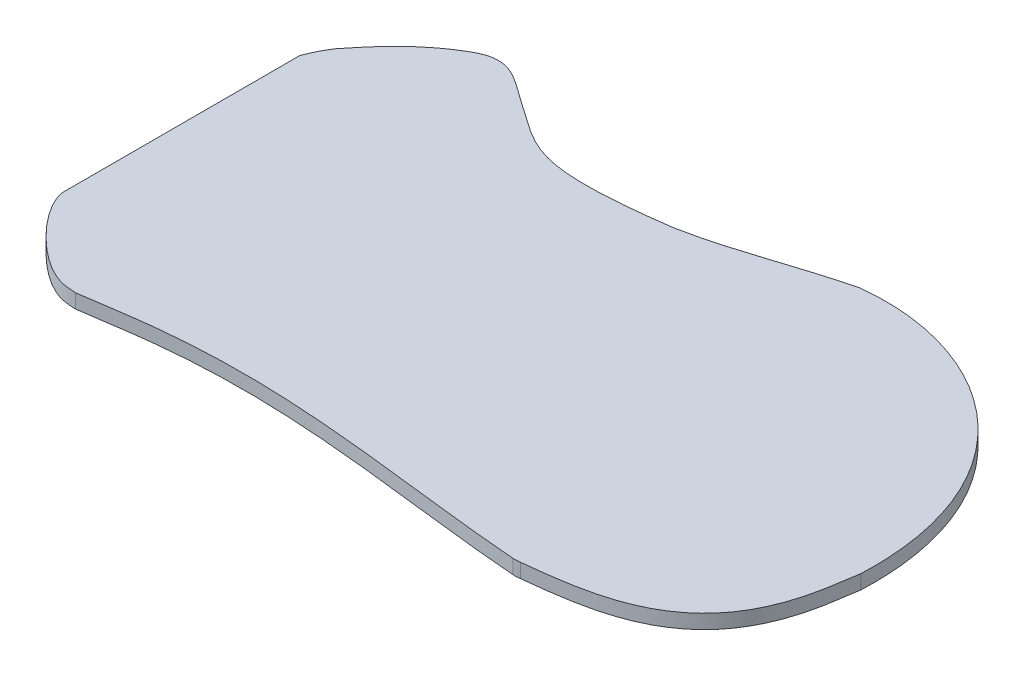
from build123d import *

# Parameters (mm, degrees)
BOSS_EXTRUDE2_DEPTH      = 3
SKETCH2_R                = 6
BOSS_EXTRUDE3_DEPTH      = 2.5
SKETCH4_R                = 2.5
CUT_EXTRUDE1_DEPTH       = 2.5
LPATTERN1_COUNT          = 3
LPATTERN1_PITCH          = 20
LPATTERN1_COUNT_DIR2     = 6
LPATTERN1_PITCH_DIR2     = 20
CUT_EXTRUDE2_DEPTH       = 10
MIRROR1_COPY_1_SKETCH_R  = 6
MIRROR1_COPY_1_DEPTH     = 2.5
MIRROR1_COPY_2_SKETCH_R  = 6
MIRROR1_COPY_2_DEPTH     = 2.5
MIRROR1_COPY_3_SKETCH_R  = 6
MIRROR1_COPY_3_DEPTH     = 2.5
MIRROR1_COPY_4_SKETCH_R  = 6
MIRROR1_COPY_4_DEPTH     = 2.5
MIRROR1_COPY_5_SKETCH_R  = 6
MIRROR1_COPY_5_DEPTH     = 2.5
MIRROR1_COPY_6_SKETCH_R  = 6
MIRROR1_COPY_6_DEPTH     = 2.5
MIRROR1_COPY_7_SKETCH_R  = 6
MIRROR1_COPY_7_DEPTH     = 2.5
MIRROR1_COPY_8_SKETCH_R  = 6
MIRROR1_COPY_8_DEPTH     = 2.5
MIRROR1_COPY_9_SKETCH_R  = 6
MIRROR1_COPY_9_DEPTH     = 2.5
MIRROR1_COPY_10_SKETCH_R = 6
MIRROR1_COPY_10_DEPTH    = 2.5
MIRROR1_COPY_11_SKETCH_R = 6
MIRROR1_COPY_11_DEPTH    = 2.5
MIRROR1_COPY_12_SKETCH_R = 6
MIRROR1_COPY_12_DEPTH    = 2.5
MIRROR1_COPY_13_SKETCH_R = 6
MIRROR1_COPY_13_DEPTH    = 2.5
MIRROR1_COPY_14_SKETCH_R = 6
MIRROR1_COPY_14_DEPTH    = 2.5
MIRROR1_COPY_15_SKETCH_R = 6
MIRROR1_COPY_15_DEPTH    = 2.5
MIRROR1_COPY_16_SKETCH_R = 6
MIRROR1_COPY_16_DEPTH    = 2.5
MIRROR1_COPY_17_SKETCH_R = 6
MIRROR1_COPY_17_DEPTH    = 2.5
MIRROR1_COPY_18_SKETCH_R = 2.5
MIRROR1_COPY_18_DEPTH    = 2.5
MIRROR1_COPY_19_SKETCH_R = 2.5
MIRROR1_COPY_19_DEPTH    = 2.5
MIRROR1_COPY_20_SKETCH_R = 2.5
MIRROR1_COPY_20_DEPTH    = 2.5
MIRROR1_COPY_21_SKETCH_R = 2.5
MIRROR1_COPY_21_DEPTH    = 2.5
MIRROR1_COPY_22_SKETCH_R = 2.5
MIRROR1_COPY_22_DEPTH    = 2.5
MIRROR1_COPY_23_SKETCH_R = 2.5
MIRROR1_COPY_23_DEPTH    = 2.5
MIRROR1_COPY_24_SKETCH_R = 2.5
MIRROR1_COPY_24_DEPTH    = 2.5
MIRROR1_COPY_25_SKETCH_R = 2.5
MIRROR1_COPY_25_DEPTH    = 2.5
MIRROR1_COPY_26_SKETCH_R = 2.5
MIRROR1_COPY_26_DEPTH    = 2.5
MIRROR1_COPY_27_SKETCH_R = 2.5
MIRROR1_COPY_27_DEPTH    = 2.5
MIRROR1_COPY_28_SKETCH_R = 2.5
MIRROR1_COPY_28_DEPTH    = 2.5
MIRROR1_COPY_29_SKETCH_R = 2.5
MIRROR1_COPY_29_DEPTH    = 2.5
MIRROR1_COPY_30_SKETCH_R = 2.5
MIRROR1_COPY_30_DEPTH    = 2.5
MIRROR1_COPY_31_SKETCH_R = 2.5
MIRROR1_COPY_31_DEPTH    = 2.5
MIRROR1_COPY_32_SKETCH_R = 2.5
MIRROR1_COPY_32_DEPTH    = 2.5
MIRROR1_COPY_33_SKETCH_R = 2.5
MIRROR1_COPY_33_DEPTH    = 2.5
MIRROR1_COPY_34_SKETCH_R = 2.5
MIRROR1_COPY_34_DEPTH    = 2.5
SKETCH6_W                = 220.416558685
SKETCH6_H                = 214.356996935
CUT_EXTRUDE3_DEPTH       = 10


with BuildPart() as part:
    # Sketch1 → Boss-Extrude2 (new body)
    with BuildSketch(Plane(origin=(0, 0, 0), x_dir=(1, 0, 0), z_dir=(0, 1, 0))):
        with BuildLine():
            Line((-77.610928287, 24.73480995), (-77.610926739, -10.995486899))
            Line((-77.610926739, -10.995486899), (77.512336703, -10.995486899))
            add(Edge.make_bspline(
                [(77.512336703, -10.995486899), (77.518560385, -10.957874405), (77.524814965, -10.920112686), (77.531107112, -10.882121857)],
                knots=[1.010486637, 1.010486637, 1.010486637, 1.010486637, 1.01412385, 1.01412385, 1.01412385, 1.01412385], degree=3))
            add(Edge.make_bspline(
                [(77.531107112, -10.882121857), (77.574839436, -9.766511083), (77.609892635, -7.507402328), (77.488817492, -4.272864758), (77.205757806, -1.125162749), (76.619514408, 2.937285367), (75.50877626, 7.753752623), (72.989524017, 14.905909338), (68.566776195, 22.780014071), (61.595696469, 30.463398286), (53.335691478, 36.314584962), (44.158321293, 40.264828436), (34.449835996, 42.250559646), (27.85746121, 42.205857253), (24.60638519, 41.843406408)],
                knots=[0.000169226, 0.000169226, 0.000169226, 0.000169226, 0.031413574, 0.062657922, 0.09390227, 0.125146618, 0.187635314, 0.25012401, 0.375101401, 0.500078793, 0.625056185, 0.750033577, 0.875010969, 0.999988361, 0.999988361, 0.999988361, 0.999988361], degree=3))
            add(Edge.make_bspline(
                [(24.60638519, 41.843406408), (19.441654305, 40.599557497), (11.868641969, 38.10186056), (1.706905963, 34.941445063), (-3.490903085, 33.661503777), (-6.113060784, 33.160531214)],
                knots=[0.000658959, 0.000658959, 0.000658959, 0.000658959, 0.498067368, 0.746771573, 0.995475778, 0.995475778, 0.995475778, 0.995475778], degree=3))
            add(Edge.make_bspline(
                [(-6.113060784, 33.160531214), (-7.141691771, 33.016316508), (-9.182526978, 32.742024746), (-13.41706461, 32.236967498), (-18.636406478, 31.76535684), (-24.35525076, 31.602322531), (-29.284430774, 31.960023989), (-33.420361612, 32.921566077), (-36.371506688, 34.261606006), (-38.649706949, 35.648097323), (-40.392953753, 36.835956096), (-41.960752384, 37.950009586), (-43.317594841, 38.899351268), (-44.070083407, 39.410677407), (-44.439121999, 39.658722592)],
                knots=[-0.00019559, -0.00019559, -0.00019559, -0.00019559, 0.062587211, 0.125370012, 0.250935613, 0.376501215, 0.502066816, 0.627632417, 0.753198019, 0.81598082, 0.87876362, 0.941546421, 0.972937821, 1.004329222, 1.004329222, 1.004329222, 1.004329222], degree=3))
            add(Edge.make_bspline(
                [(-44.439121999, 39.658722592), (-44.698278493, 39.837478936), (-45.221943057, 40.202686415), (-46.204449693, 40.903278583), (-47.345032131, 41.729218311), (-48.599765224, 42.619793879), (-50.15090873, 43.651280208), (-51.914572875, 44.618913698), (-53.861511808, 45.22944075), (-55.705524128, 45.327541985), (-57.164765963, 45.050979151), (-58.248551256, 44.683932663), (-59.000335406, 44.361625817), (-59.68368912, 44.01293032), (-60.037538284, 43.806100934), (-60.223947924, 43.693990747)],
                knots=[-0.002497219, -0.002497219, -0.002497219, -0.002497219, 0.029065652, 0.060628523, 0.123754265, 0.186880007, 0.250005749, 0.376257234, 0.502508718, 0.628760202, 0.755011687, 0.818137429, 0.881263171, 0.944388913, 1.007514655, 1.007514655, 1.007514655, 1.007514655], degree=3))
            add(Edge.make_bspline(
                [(-60.223947924, 43.693990747), (-60.647418813, 43.446259773), (-61.492438659, 42.931359573), (-63.090560833, 41.877343183), (-65.712449046, 39.946479206), (-68.970886279, 37.019932698), (-71.698068002, 34.035828956), (-73.643714468, 31.694824796), (-74.523586793, 30.588052824), (-74.969576783, 30.022283972)],
                knots=[0.000174078, 0.000174078, 0.000174078, 0.000174078, 0.062881444, 0.12558881, 0.251003541, 0.501833004, 0.752662466, 0.878077198, 1.003491929, 1.003491929, 1.003491929, 1.003491929], degree=3))
            add(Edge.make_bspline(
                [(-74.969576783, 30.022283972), (-75.519545883, 29.19186114), (-76.530249869, 27.448037515), (-77.287396087, 25.657695857), (-77.610928287, 24.73480995)],
                knots=[0.499549048, 0.499549048, 0.499549048, 0.499549048, 0.499765799, 0.49998255, 0.49998255, 0.49998255, 0.49998255], degree=3))
        make_face()
        with BuildLine():
            Line((77.512336703, -10.995486899), (-77.610926739, -10.995486899))
            Line((-77.610926739, -10.995486899), (-77.610926696, -11.995486899))
            Line((-77.610926696, -11.995486899), (77.352572442, -11.995486899))
            add(Edge.make_bspline(
                [(77.352572442, -11.995486899), (77.358645684, -11.955275612), (77.412259186, -11.602816601), (77.464316371, -11.285695229), (77.512336703, -10.995486899)],
                knots=[0.978851886, 0.978851886, 0.978851886, 0.978851886, 0.982422834, 1.010486637, 1.010486637, 1.010486637, 1.010486637], degree=3))
        make_face()
        with BuildLine():
            Line((77.352572442, -11.995486899), (-77.610926696, -11.995486899))
            Line((-77.610926696, -11.995486899), (-77.610926126, -25.14203309))
            add(Edge.make_bspline(
                [(-77.610926126, -25.14203309), (-77.610329581, -25.399956565), (-77.56299042, -25.903042711), (-77.289715127, -26.985745976), (-76.641681648, -28.530602527), (-75.497775654, -30.448110961), (-73.605831916, -33.039049782), (-70.803315368, -36.111993436), (-67.327412016, -39.127002194), (-64.140223394, -41.243972104), (-61.455644843, -42.436069514), (-59.281170991, -42.877843858), (-58.025592683, -42.909198362), (-57.3728408, -42.946603583)],
                knots=[0.000484301, 0.000484301, 0.000484301, 0.000484301, 0.031521334, 0.062558366, 0.124632431, 0.186706496, 0.248780561, 0.37292869, 0.49707682, 0.62122495, 0.745373079, 0.869521209, 0.993669339, 0.993669339, 0.993669339, 0.993669339], degree=3))
            add(Edge.make_bspline(
                [(-57.3728408, -42.946603583), (-57.13064829, -42.917162583), (-56.655899826, -42.857244252), (-55.632891969, -42.716833971), (-54.283173397, -42.517569574), (-52.529691334, -42.248220025), (-50.028198289, -41.865201142), (-46.600250729, -41.367044153), (-42.036258597, -40.811127611), (-37.051373779, -40.355934431), (-29.881163552, -39.94286355), (-20.010895236, -39.876612938), (-6.937670032, -40.617368244), (4.79101559, -41.816338855), (14.569227449, -42.959318591), (22.067232439, -43.838869966), (29.700051426, -44.671831852), (34.887053568, -45.137323321), (37.472492496, -45.32880882)],
                knots=[0.000538145, 0.000538145, 0.000538145, 0.000538145, 0.016151963, 0.031765781, 0.062993416, 0.094221052, 0.125448688, 0.18790396, 0.250359232, 0.312814503, 0.375269775, 0.500180319, 0.625090862, 0.750001406, 0.812456678, 0.874911949, 0.937367221, 0.999822493, 0.999822493, 0.999822493, 0.999822493], degree=3))
            ThreePointArc((37.472492496, -45.32880882), (38.248733412, -45.324262341), (39.021479233, -45.250543112))
            add(Edge.make_bspline(
                [(39.021479233, -45.250543112), (40.554063275, -45.087269156), (43.636191946, -44.744534775), (49.629747374, -43.872748427), (56.64310661, -42.215757501), (63.76459646, -38.913707507), (69.322535256, -34.215518596), (72.595951354, -29.308690908), (74.463908277, -25.056718438), (75.526739474, -21.803040338), (76.297079472, -18.602211114), (76.745734786, -16.093857572), (77.025988143, -14.25776708), (77.200159766, -13.042150967), (77.304730613, -12.312250405), (77.352572442, -11.995486899)],
                knots=[-0.000308659, -0.000308659, -0.000308659, -0.000308659, 0.063093373, 0.126495404, 0.253299468, 0.380103532, 0.506907596, 0.633711659, 0.697113691, 0.760515723, 0.823917755, 0.887319787, 0.919020803, 0.950721818, 0.978851886, 0.978851886, 0.978851886, 0.978851886], degree=3))
        make_face()
    boss_extrude2 = extrude(amount=BOSS_EXTRUDE2_DEPTH)

    # Sketch2 → Boss-Extrude3 (add)
    with BuildSketch(Plane(origin=(0, 3, 0), x_dir=(1, 0, 0), z_dir=(0, 1, 0))):
        with Locations(Location((-52.601285046, 19.444993701, 0), (0, 0, 270))):
            Circle(SKETCH2_R)
    boss_extrude3 = extrude(amount=BOSS_EXTRUDE3_DEPTH)

    # Sketch4 → Cut-Extrude1 (cut)
    with BuildSketch(Plane(origin=(0, 5.5, 0), x_dir=(1, 0, 0), z_dir=(0, 1, 0))):
        with Locations(Location((-52.601285046, 19.444993701, 0), (0, 0, 270))):
            Circle(SKETCH4_R)
    cut_extrude1 = extrude(amount=-CUT_EXTRUDE1_DEPTH, mode=Mode.SUBTRACT)

    # LPattern1: Boss-Extrude3, Cut-Extrude1 3 × 6
    with Locations(*[(j * LPATTERN1_PITCH_DIR2, 0, i * LPATTERN1_PITCH) for i in range(LPATTERN1_COUNT) for j in range(LPATTERN1_COUNT_DIR2) if (i, j) != (0, 0)]):
        add(boss_extrude3)
        add(cut_extrude1, mode=Mode.SUBTRACT)

    # Sketch5 → Cut-Extrude2 (cut)
    with BuildSketch(Plane.XZ):
        with BuildLine():
            Line((-77.610926126, 25.14203309), (-77.610928287, -24.73480995))
            add(Edge.make_bspline(
                [(-77.610928287, -24.73480995), (-77.287396087, -25.657695857), (-76.530249869, -27.448037515), (-75.519545883, -29.19186114), (-74.969576783, -30.022283972)],
                knots=[0.499549048, 0.499549048, 0.499549048, 0.499549048, 0.499765799, 0.49998255, 0.49998255, 0.49998255, 0.49998255], degree=3))
            add(Edge.make_bspline(
                [(-74.969576783, -30.022283972), (-74.523586793, -30.588052824), (-73.643714468, -31.694824796), (-71.698068002, -34.035828956), (-68.970886279, -37.019932698), (-65.712449046, -39.946479206), (-63.090560833, -41.877343183), (-61.492438659, -42.931359573), (-60.647418813, -43.446259773), (-60.223947924, -43.693990747)],
                knots=[0.000174078, 0.000174078, 0.000174078, 0.000174078, 0.12558881, 0.251003541, 0.501833004, 0.752662466, 0.878077198, 0.940784563, 1.003491929, 1.003491929, 1.003491929, 1.003491929], degree=3))
            add(Edge.make_bspline(
                [(-60.223947924, -43.693990747), (-60.037538284, -43.806100934), (-59.68368912, -44.01293032), (-59.000335406, -44.361625817), (-58.248551256, -44.683932663), (-57.164765963, -45.050979151), (-55.705524128, -45.327541985), (-53.861511808, -45.22944075), (-51.914572875, -44.618913698), (-50.15090873, -43.651280208), (-48.599765224, -42.619793879), (-47.345032131, -41.729218311), (-46.204449693, -40.903278583), (-45.221943057, -40.202686415), (-44.698278493, -39.837478936), (-44.439121999, -39.658722592)],
                knots=[-0.002497219, -0.002497219, -0.002497219, -0.002497219, 0.060628523, 0.123754265, 0.186880007, 0.250005749, 0.376257234, 0.502508718, 0.628760202, 0.755011687, 0.818137429, 0.881263171, 0.944388913, 0.975951784, 1.007514655, 1.007514655, 1.007514655, 1.007514655], degree=3))
            add(Edge.make_bspline(
                [(-44.439121999, -39.658722592), (-44.070083407, -39.410677407), (-43.317594841, -38.899351268), (-41.960752384, -37.950009586), (-40.392953753, -36.835956096), (-38.649706949, -35.648097323), (-36.371506688, -34.261606006), (-33.420361612, -32.921566077), (-29.284430774, -31.960023989), (-24.35525076, -31.602322531), (-18.636406478, -31.76535684), (-13.41706461, -32.236967498), (-9.182526978, -32.742024746), (-7.141691771, -33.016316508), (-6.113060784, -33.160531214)],
                knots=[-0.00019559, -0.00019559, -0.00019559, -0.00019559, 0.031195811, 0.062587211, 0.125370012, 0.188152813, 0.250935613, 0.376501215, 0.502066816, 0.627632417, 0.753198019, 0.87876362, 0.941546421, 1.004329222, 1.004329222, 1.004329222, 1.004329222], degree=3))
            add(Edge.make_bspline(
                [(-6.113060784, -33.160531214), (-3.490903085, -33.661503777), (1.706905963, -34.941445063), (11.868641969, -38.10186056), (19.441654305, -40.599557497), (24.60638519, -41.843406408)],
                knots=[0.000658959, 0.000658959, 0.000658959, 0.000658959, 0.249363164, 0.498067368, 0.995475778, 0.995475778, 0.995475778, 0.995475778], degree=3))
            add(Edge.make_bspline(
                [(24.60638519, -41.843406408), (27.85746121, -42.205857253), (34.449835996, -42.250559646), (44.158321293, -40.264828436), (53.335691478, -36.314584962), (61.595696469, -30.463398286), (68.566776195, -22.780014071), (72.989524017, -14.905909338), (75.50877626, -7.753752623), (76.619514408, -2.937285367), (77.205757806, 1.125162749), (77.488817492, 4.272864758), (77.609892635, 7.507402328), (77.574839436, 9.766511083), (77.531107112, 10.882121857)],
                knots=[0.000169226, 0.000169226, 0.000169226, 0.000169226, 0.125146618, 0.25012401, 0.375101401, 0.500078793, 0.625056185, 0.750033577, 0.812522273, 0.875010969, 0.906255317, 0.937499665, 0.968744013, 0.999988361, 0.999988361, 0.999988361, 0.999988361], degree=3))
            add(Edge.make_bspline(
                [(77.531107112, 10.882121857), (77.476266373, 11.213240152), (77.372292542, 11.840668503), (77.206954736, 12.994726044), (77.025988143, 14.25776708), (76.745734786, 16.093857572), (76.297079472, 18.602211114), (75.526739474, 21.803040338), (74.463908277, 25.056718438), (72.595951354, 29.308690908), (69.322535256, 34.215518596), (63.76459646, 38.913707507), (56.64310661, 42.215757501), (49.629747374, 43.872748427), (43.636191946, 44.744534775), (40.554063275, 45.087269156), (39.021479233, 45.250543112)],
                knots=[-0.000308659, -0.000308659, -0.000308659, -0.000308659, 0.031392357, 0.063093373, 0.094794388, 0.126495404, 0.189897436, 0.253299468, 0.3167015, 0.380103532, 0.506907596, 0.633711659, 0.760515723, 0.887319787, 0.950721818, 1.01412385, 1.01412385, 1.01412385, 1.01412385], degree=3))
            ThreePointArc((39.021479233, 45.250543112), (38.248733412, 45.324262341), (37.472492496, 45.32880882))
            add(Edge.make_bspline(
                [(37.472492496, 45.32880882), (34.887053568, 45.137323321), (29.700051426, 44.671831852), (22.067232439, 43.838869966), (14.569227449, 42.959318591), (4.79101559, 41.816338855), (-6.937670032, 40.617368244), (-20.010895236, 39.876612938), (-29.881163552, 39.94286355), (-37.051373779, 40.355934431), (-42.036258597, 40.811127611), (-46.600250729, 41.367044153), (-50.028198289, 41.865201142), (-52.529691334, 42.248220025), (-54.283173397, 42.517569574), (-55.632891969, 42.716833971), (-56.655899826, 42.857244252), (-57.13064829, 42.917162583), (-57.3728408, 42.946603583)],
                knots=[0.000538145, 0.000538145, 0.000538145, 0.000538145, 0.062993416, 0.125448688, 0.18790396, 0.250359232, 0.375269775, 0.500180319, 0.625090862, 0.687546134, 0.750001406, 0.812456678, 0.874911949, 0.906139585, 0.937367221, 0.968594857, 0.984208675, 0.999822493, 0.999822493, 0.999822493, 0.999822493], degree=3))
            add(Edge.make_bspline(
                [(-57.3728408, 42.946603583), (-58.025592683, 42.909198362), (-59.281170991, 42.877843858), (-61.455644843, 42.436069514), (-64.140223394, 41.243972104), (-67.327412016, 39.127002194), (-70.803315368, 36.111993436), (-73.605831916, 33.039049782), (-75.497775654, 30.448110961), (-76.641681648, 28.530602527), (-77.289715127, 26.985745976), (-77.56299042, 25.903042711), (-77.610329581, 25.399956565), (-77.610926126, 25.14203309)],
                knots=[0.000484301, 0.000484301, 0.000484301, 0.000484301, 0.124632431, 0.248780561, 0.37292869, 0.49707682, 0.62122495, 0.745373079, 0.807447144, 0.869521209, 0.931595274, 0.962632306, 0.993669339, 0.993669339, 0.993669339, 0.993669339], degree=3))
        make_face()
        with BuildLine():
            Line((-77.110924614, 25.142033064), (-77.110928283, -24.649235594))
            add(Edge.make_bspline(
                [(-77.110928283, -24.649235594), (-76.796834646, -25.534719204), (-76.065527361, -27.251496842), (-75.092441504, -28.929749169), (-74.564057917, -29.729049984)],
                knots=[0.49955544, 0.49955544, 0.49955544, 0.49955544, 0.499768234, 0.499981028, 0.499981028, 0.499981028, 0.499981028], degree=3))
            add(Edge.make_bspline(
                [(-74.564057917, -29.729049984), (-74.120028713, -30.29224047), (-73.243253406, -31.394758544), (-71.31002157, -33.719718296), (-68.607468868, -36.674842785), (-65.386774295, -39.565763591), (-62.797921849, -41.471529936), (-61.220871686, -42.511383695), (-60.386786038, -43.019457783), (-59.968855024, -43.263947924)],
                knots=[0.001381154, 0.001381154, 0.001381154, 0.001381154, 0.126661169, 0.251941185, 0.502501216, 0.753061247, 0.878341262, 0.94098127, 1.003621278, 1.003621278, 1.003621278, 1.003621278], degree=3))
            add(Edge.make_bspline(
                [(-59.968855024, -43.263947924), (-59.788699396, -43.372296833), (-59.44559718, -43.573015316), (-58.572516315, -44.018663419), (-57.316649032, -44.512636992), (-55.670646999, -44.823798435), (-53.957941799, -44.733009647), (-52.123090734, -44.160977925), (-50.413072778, -43.225048029), (-48.884357531, -42.208602546), (-47.63666174, -41.323079193), (-46.495584289, -40.496768166), (-45.508073832, -39.792624212), (-44.981209447, -39.425227253), (-44.720540472, -39.245427656)],
                knots=[-0.002790901, -0.002790901, -0.002790901, -0.002790901, 0.060359484, 0.123509868, 0.249810637, 0.376111405, 0.502412174, 0.628712942, 0.755013711, 0.818164095, 0.88131448, 0.944464864, 0.976040056, 1.007615248, 1.007615248, 1.007615248, 1.007615248], degree=3))
            add(Edge.make_bspline(
                [(-44.720540472, -39.245427656), (-44.352964806, -38.99836576), (-43.603458324, -38.489114441), (-42.251849454, -37.54347035), (-40.681613327, -36.427666966), (-38.92352984, -35.229499832), (-36.606357517, -33.818719745), (-33.577525903, -32.443023972), (-29.348316666, -31.461970388), (-24.354924698, -31.101492051), (-18.595465912, -31.266628413), (-13.35457476, -31.740717947), (-9.107884909, -32.24744852), (-7.062492021, -32.522530222), (-6.031385282, -32.66709203)],
                knots=[-0.000266425, -0.000266425, -0.000266425, -0.000266425, 0.03113498, 0.062536385, 0.125339195, 0.188142004, 0.250944814, 0.376550434, 0.502156054, 0.627761674, 0.753367294, 0.878972914, 0.941775724, 1.004578534, 1.004578534, 1.004578534, 1.004578534], degree=3))
            add(Edge.make_bspline(
                [(-6.031385282, -32.66709203), (-3.397307921, -33.170341887), (1.829158017, -34.455813029), (12.009434397, -37.621737101), (19.543113629, -40.107918141), (24.692917961, -41.349945265)],
                knots=[0.000274697, 0.000274697, 0.000274697, 0.000274697, 0.248828601, 0.497382505, 0.994490313, 0.994490313, 0.994490313, 0.994490313], degree=3))
            add(Edge.make_bspline(
                [(24.692917961, -41.349945265), (27.907540045, -41.706130192), (34.425147396, -41.746452779), (44.024431684, -39.778623719), (53.099173214, -35.869224303), (61.264499908, -30.082795078), (68.155207265, -22.48759176), (72.528988603, -14.703656081), (75.023098047, -7.629005673), (76.12411535, -2.862109816), (76.706214871, 1.160505032), (76.987925139, 4.279503088), (77.109357184, 7.483290024), (77.075583539, 9.724844948), (77.032706821, 10.831337819)],
                knots=[0.00057245, 0.00057245, 0.00057245, 0.00057245, 0.125462774, 0.250353098, 0.375243422, 0.500133745, 0.625024069, 0.749914393, 0.812359555, 0.874804717, 0.906027298, 0.937249879, 0.96847246, 0.99969504, 0.99969504, 0.99969504, 0.99969504], degree=3))
            add(Edge.make_bspline(
                [(77.032706821, 10.831337819), (76.977476906, 11.164820706), (76.87332098, 11.796056427), (76.706670884, 12.961765145), (76.525785099, 14.222566554), (76.245781864, 16.052293483), (75.79882004, 18.541072863), (75.033822164, 21.706873229), (73.981825938, 24.915370283), (72.139002354, 29.095886165), (68.922923199, 33.901297606), (63.475591857, 38.496640888), (56.467141381, 41.743475262), (49.520717541, 43.383746023), (43.563213191, 44.249642076), (40.487817955, 44.591497181), (38.960033369, 44.754259827)],
                knots=[0.00067937, 0.00067937, 0.00067937, 0.00067937, 0.032353163, 0.064026957, 0.09570075, 0.127374543, 0.19072213, 0.254069717, 0.317417304, 0.380764891, 0.507460065, 0.634155239, 0.760850413, 0.887545587, 0.950893174, 1.014240761, 1.014240761, 1.014240761, 1.014240761], degree=3))
            ThreePointArc((38.960033369, 44.754259827), (38.231962167, 44.824467523), (37.500531166, 44.82951583))
            add(Edge.make_bspline(
                [(37.500531166, 44.82951583), (34.921920632, 44.638442913), (29.749958487, 44.174233303), (19.591637504, 43.065819822), (7.217203779, 41.562239246), (-6.861387278, 40.122019198), (-19.951824316, 39.377960274), (-29.844680351, 39.44148494), (-37.035426517, 39.853305092), (-42.035547046, 40.308150738), (-46.613550825, 40.864282532), (-50.050499861, 41.362952013), (-52.555840009, 41.746338507), (-54.310366197, 42.015961616), (-55.657250496, 42.215166793), (-56.677719187, 42.355748693), (-57.148517515, 42.415506009), (-57.389072815, 42.444883686)],
                knots=[0.000609886, 0.000609886, 0.000609886, 0.000609886, 0.063000999, 0.125392113, 0.250174339, 0.374956565, 0.499738792, 0.624521018, 0.686912131, 0.749303244, 0.811694357, 0.874085471, 0.905281027, 0.936476584, 0.96767214, 0.983269919, 0.998867697, 0.998867697, 0.998867697, 0.998867697], degree=3))
            add(Edge.make_bspline(
                [(-57.389072815, 42.444883686), (-57.710549236, 42.426892979), (-58.359606261, 42.39972312), (-59.610366584, 42.302198356), (-61.331661946, 41.946002939), (-63.930553529, 40.78544015), (-67.057206872, 38.702024139), (-70.481375761, 35.725413714), (-73.239096855, 32.696025776), (-75.091914872, 30.153824256), (-76.200785171, 28.291112405), (-76.819332544, 26.809716823), (-77.06943411, 25.809846882), (-77.110326671, 25.370650581), (-77.110924614, 25.142033064)],
                knots=[0.003286906, 0.003286906, 0.003286906, 0.003286906, 0.06518253, 0.127078153, 0.2508694, 0.374660647, 0.498451894, 0.622243141, 0.746034389, 0.807930012, 0.869825636, 0.931721259, 0.962669071, 0.993616883, 0.993616883, 0.993616883, 0.993616883], degree=3))
        make_face(mode=Mode.SUBTRACT)
    cut_extrude2 = extrude(amount=-CUT_EXTRUDE2_DEPTH, mode=Mode.SUBTRACT)

    # Mirror1: Boss-Extrude2, Boss-Extrude3, Cut-Extrude1, Cut-Extrude2 across plane
    add(boss_extrude2.mirror(Plane(origin=(0, 0, 0), x_dir=(0, 0, 1), z_dir=(0, -1, 0))))
    add(boss_extrude3.mirror(Plane(origin=(0, 0, 0), x_dir=(0, 0, 1), z_dir=(0, -1, 0))))
    add(cut_extrude1.mirror(Plane(origin=(0, 0, 0), x_dir=(0, 0, 1), z_dir=(0, -1, 0))), mode=Mode.SUBTRACT)
    add(cut_extrude2.mirror(Plane(origin=(0, 0, 0), x_dir=(0, 0, 1), z_dir=(0, -1, 0))), mode=Mode.SUBTRACT)

    # Mirror1 copy 1 sketch → Mirror1 copy 1 (add)
    with BuildSketch(Plane(origin=(20, -3, -8.66e-07), x_dir=(1, 0, 0), z_dir=(0, -1, 0))):
        with Locations((-52.601285046, -19.444993701)):
            Circle(MIRROR1_COPY_1_SKETCH_R)
    extrude(amount=MIRROR1_COPY_1_DEPTH)

    # Mirror1 copy 2 sketch → Mirror1 copy 2 (add)
    with BuildSketch(Plane(origin=(40, -3, -1.733e-06), x_dir=(1, 0, 0), z_dir=(0, -1, 0))):
        with Locations((-52.601285046, -19.444993701)):
            Circle(MIRROR1_COPY_2_SKETCH_R)
    extrude(amount=MIRROR1_COPY_2_DEPTH)

    # Mirror1 copy 3 sketch → Mirror1 copy 3 (add)
    with BuildSketch(Plane(origin=(60, -3, -2.599e-06), x_dir=(1, 0, 0), z_dir=(0, -1, 0))):
        with Locations((-52.601285046, -19.444993701)):
            Circle(MIRROR1_COPY_3_SKETCH_R)
    extrude(amount=MIRROR1_COPY_3_DEPTH)

    # Mirror1 copy 4 sketch → Mirror1 copy 4 (add)
    with BuildSketch(Plane(origin=(80, -3, -3.465e-06), x_dir=(1, 0, 0), z_dir=(0, -1, 0))):
        with Locations((-52.601285046, -19.444993701)):
            Circle(MIRROR1_COPY_4_SKETCH_R)
    extrude(amount=MIRROR1_COPY_4_DEPTH)

    # Mirror1 copy 5 sketch → Mirror1 copy 5 (add)
    with BuildSketch(Plane(origin=(100, -3, -4.332e-06), x_dir=(1, 0, 0), z_dir=(0, -1, 0))):
        with Locations((-52.601285046, -19.444993701)):
            Circle(MIRROR1_COPY_5_SKETCH_R)
    extrude(amount=MIRROR1_COPY_5_DEPTH)

    # Mirror1 copy 6 sketch → Mirror1 copy 6 (add)
    with BuildSketch(Plane(origin=(8.66e-07, -3, 20), x_dir=(1, 0, 0), z_dir=(0, -1, 0))):
        with Locations((-52.601285046, -19.444993701)):
            Circle(MIRROR1_COPY_6_SKETCH_R)
    extrude(amount=MIRROR1_COPY_6_DEPTH)

    # Mirror1 copy 7 sketch → Mirror1 copy 7 (add)
    with BuildSketch(Plane(origin=(20.000000866, -3, 19.999999134), x_dir=(1, 0, 0), z_dir=(0, -1, 0))):
        with Locations((-52.601285046, -19.444993701)):
            Circle(MIRROR1_COPY_7_SKETCH_R)
    extrude(amount=MIRROR1_COPY_7_DEPTH)

    # Mirror1 copy 8 sketch → Mirror1 copy 8 (add)
    with BuildSketch(Plane(origin=(40.000000866, -3, 19.999998267), x_dir=(1, 0, 0), z_dir=(0, -1, 0))):
        with Locations((-52.601285046, -19.444993701)):
            Circle(MIRROR1_COPY_8_SKETCH_R)
    extrude(amount=MIRROR1_COPY_8_DEPTH)

    # Mirror1 copy 9 sketch → Mirror1 copy 9 (add)
    with BuildSketch(Plane(origin=(60.000000866, -3, 19.999997401), x_dir=(1, 0, 0), z_dir=(0, -1, 0))):
        with Locations((-52.601285046, -19.444993701)):
            Circle(MIRROR1_COPY_9_SKETCH_R)
    extrude(amount=MIRROR1_COPY_9_DEPTH)

    # Mirror1 copy 10 sketch → Mirror1 copy 10 (add)
    with BuildSketch(Plane(origin=(80.000000866, -3, 19.999996535), x_dir=(1, 0, 0), z_dir=(0, -1, 0))):
        with Locations((-52.601285046, -19.444993701)):
            Circle(MIRROR1_COPY_10_SKETCH_R)
    extrude(amount=MIRROR1_COPY_10_DEPTH)

    # Mirror1 copy 11 sketch → Mirror1 copy 11 (add)
    with BuildSketch(Plane(origin=(100.000000866, -3, 19.999995668), x_dir=(1, 0, 0), z_dir=(0, -1, 0))):
        with Locations((-52.601285046, -19.444993701)):
            Circle(MIRROR1_COPY_11_SKETCH_R)
    extrude(amount=MIRROR1_COPY_11_DEPTH)

    # Mirror1 copy 12 sketch → Mirror1 copy 12 (add)
    with BuildSketch(Plane(origin=(1.733e-06, -3, 40), x_dir=(1, 0, 0), z_dir=(0, -1, 0))):
        with Locations((-52.601285046, -19.444993701)):
            Circle(MIRROR1_COPY_12_SKETCH_R)
    extrude(amount=MIRROR1_COPY_12_DEPTH)

    # Mirror1 copy 13 sketch → Mirror1 copy 13 (add)
    with BuildSketch(Plane(origin=(20.000001733, -3, 39.999999134), x_dir=(1, 0, 0), z_dir=(0, -1, 0))):
        with Locations((-52.601285046, -19.444993701)):
            Circle(MIRROR1_COPY_13_SKETCH_R)
    extrude(amount=MIRROR1_COPY_13_DEPTH)

    # Mirror1 copy 14 sketch → Mirror1 copy 14 (add)
    with BuildSketch(Plane(origin=(40.000001733, -3, 39.999998267), x_dir=(1, 0, 0), z_dir=(0, -1, 0))):
        with Locations((-52.601285046, -19.444993701)):
            Circle(MIRROR1_COPY_14_SKETCH_R)
    extrude(amount=MIRROR1_COPY_14_DEPTH)

    # Mirror1 copy 15 sketch → Mirror1 copy 15 (add)
    with BuildSketch(Plane(origin=(60.000001733, -3, 39.999997401), x_dir=(1, 0, 0), z_dir=(0, -1, 0))):
        with Locations((-52.601285046, -19.444993701)):
            Circle(MIRROR1_COPY_15_SKETCH_R)
    extrude(amount=MIRROR1_COPY_15_DEPTH)

    # Mirror1 copy 16 sketch → Mirror1 copy 16 (add)
    with BuildSketch(Plane(origin=(80.000001733, -3, 39.999996535), x_dir=(1, 0, 0), z_dir=(0, -1, 0))):
        with Locations((-52.601285046, -19.444993701)):
            Circle(MIRROR1_COPY_16_SKETCH_R)
    extrude(amount=MIRROR1_COPY_16_DEPTH)

    # Mirror1 copy 17 sketch → Mirror1 copy 17 (add)
    with BuildSketch(Plane(origin=(100.000001733, -3, 39.999995668), x_dir=(1, 0, 0), z_dir=(0, -1, 0))):
        with Locations((-52.601285046, -19.444993701)):
            Circle(MIRROR1_COPY_17_SKETCH_R)
    extrude(amount=MIRROR1_COPY_17_DEPTH)

    # Mirror1 copy 18 sketch → Mirror1 copy 18 (cut)
    with BuildSketch(Plane(origin=(20, -5.5, -8.66e-07), x_dir=(1, 0, 0), z_dir=(0, -1, 0))):
        with Locations((-52.601285046, -19.444993701)):
            Circle(MIRROR1_COPY_18_SKETCH_R)
    extrude(amount=-MIRROR1_COPY_18_DEPTH, mode=Mode.SUBTRACT)

    # Mirror1 copy 19 sketch → Mirror1 copy 19 (cut)
    with BuildSketch(Plane(origin=(40, -5.5, -1.733e-06), x_dir=(1, 0, 0), z_dir=(0, -1, 0))):
        with Locations((-52.601285046, -19.444993701)):
            Circle(MIRROR1_COPY_19_SKETCH_R)
    extrude(amount=-MIRROR1_COPY_19_DEPTH, mode=Mode.SUBTRACT)

    # Mirror1 copy 20 sketch → Mirror1 copy 20 (cut)
    with BuildSketch(Plane(origin=(60, -5.5, -2.599e-06), x_dir=(1, 0, 0), z_dir=(0, -1, 0))):
        with Locations((-52.601285046, -19.444993701)):
            Circle(MIRROR1_COPY_20_SKETCH_R)
    extrude(amount=-MIRROR1_COPY_20_DEPTH, mode=Mode.SUBTRACT)

    # Mirror1 copy 21 sketch → Mirror1 copy 21 (cut)
    with BuildSketch(Plane(origin=(80, -5.5, -3.465e-06), x_dir=(1, 0, 0), z_dir=(0, -1, 0))):
        with Locations((-52.601285046, -19.444993701)):
            Circle(MIRROR1_COPY_21_SKETCH_R)
    extrude(amount=-MIRROR1_COPY_21_DEPTH, mode=Mode.SUBTRACT)

    # Mirror1 copy 22 sketch → Mirror1 copy 22 (cut)
    with BuildSketch(Plane(origin=(100, -5.5, -4.332e-06), x_dir=(1, 0, 0), z_dir=(0, -1, 0))):
        with Locations((-52.601285046, -19.444993701)):
            Circle(MIRROR1_COPY_22_SKETCH_R)
    extrude(amount=-MIRROR1_COPY_22_DEPTH, mode=Mode.SUBTRACT)

    # Mirror1 copy 23 sketch → Mirror1 copy 23 (cut)
    with BuildSketch(Plane(origin=(8.66e-07, -5.5, 20), x_dir=(1, 0, 0), z_dir=(0, -1, 0))):
        with Locations((-52.601285046, -19.444993701)):
            Circle(MIRROR1_COPY_23_SKETCH_R)
    extrude(amount=-MIRROR1_COPY_23_DEPTH, mode=Mode.SUBTRACT)

    # Mirror1 copy 24 sketch → Mirror1 copy 24 (cut)
    with BuildSketch(Plane(origin=(20.000000866, -5.5, 19.999999134), x_dir=(1, 0, 0), z_dir=(0, -1, 0))):
        with Locations((-52.601285046, -19.444993701)):
            Circle(MIRROR1_COPY_24_SKETCH_R)
    extrude(amount=-MIRROR1_COPY_24_DEPTH, mode=Mode.SUBTRACT)

    # Mirror1 copy 25 sketch → Mirror1 copy 25 (cut)
    with BuildSketch(Plane(origin=(40.000000866, -5.5, 19.999998267), x_dir=(1, 0, 0), z_dir=(0, -1, 0))):
        with Locations((-52.601285046, -19.444993701)):
            Circle(MIRROR1_COPY_25_SKETCH_R)
    extrude(amount=-MIRROR1_COPY_25_DEPTH, mode=Mode.SUBTRACT)

    # Mirror1 copy 26 sketch → Mirror1 copy 26 (cut)
    with BuildSketch(Plane(origin=(60.000000866, -5.5, 19.999997401), x_dir=(1, 0, 0), z_dir=(0, -1, 0))):
        with Locations((-52.601285046, -19.444993701)):
            Circle(MIRROR1_COPY_26_SKETCH_R)
    extrude(amount=-MIRROR1_COPY_26_DEPTH, mode=Mode.SUBTRACT)

    # Mirror1 copy 27 sketch → Mirror1 copy 27 (cut)
    with BuildSketch(Plane(origin=(80.000000866, -5.5, 19.999996535), x_dir=(1, 0, 0), z_dir=(0, -1, 0))):
        with Locations((-52.601285046, -19.444993701)):
            Circle(MIRROR1_COPY_27_SKETCH_R)
    extrude(amount=-MIRROR1_COPY_27_DEPTH, mode=Mode.SUBTRACT)

    # Mirror1 copy 28 sketch → Mirror1 copy 28 (cut)
    with BuildSketch(Plane(origin=(100.000000866, -5.5, 19.999995668), x_dir=(1, 0, 0), z_dir=(0, -1, 0))):
        with Locations((-52.601285046, -19.444993701)):
            Circle(MIRROR1_COPY_28_SKETCH_R)
    extrude(amount=-MIRROR1_COPY_28_DEPTH, mode=Mode.SUBTRACT)

    # Mirror1 copy 29 sketch → Mirror1 copy 29 (cut)
    with BuildSketch(Plane(origin=(1.733e-06, -5.5, 40), x_dir=(1, 0, 0), z_dir=(0, -1, 0))):
        with Locations((-52.601285046, -19.444993701)):
            Circle(MIRROR1_COPY_29_SKETCH_R)
    extrude(amount=-MIRROR1_COPY_29_DEPTH, mode=Mode.SUBTRACT)

    # Mirror1 copy 30 sketch → Mirror1 copy 30 (cut)
    with BuildSketch(Plane(origin=(20.000001733, -5.5, 39.999999134), x_dir=(1, 0, 0), z_dir=(0, -1, 0))):
        with Locations((-52.601285046, -19.444993701)):
            Circle(MIRROR1_COPY_30_SKETCH_R)
    extrude(amount=-MIRROR1_COPY_30_DEPTH, mode=Mode.SUBTRACT)

    # Mirror1 copy 31 sketch → Mirror1 copy 31 (cut)
    with BuildSketch(Plane(origin=(40.000001733, -5.5, 39.999998267), x_dir=(1, 0, 0), z_dir=(0, -1, 0))):
        with Locations((-52.601285046, -19.444993701)):
            Circle(MIRROR1_COPY_31_SKETCH_R)
    extrude(amount=-MIRROR1_COPY_31_DEPTH, mode=Mode.SUBTRACT)

    # Mirror1 copy 32 sketch → Mirror1 copy 32 (cut)
    with BuildSketch(Plane(origin=(60.000001733, -5.5, 39.999997401), x_dir=(1, 0, 0), z_dir=(0, -1, 0))):
        with Locations((-52.601285046, -19.444993701)):
            Circle(MIRROR1_COPY_32_SKETCH_R)
    extrude(amount=-MIRROR1_COPY_32_DEPTH, mode=Mode.SUBTRACT)

    # Mirror1 copy 33 sketch → Mirror1 copy 33 (cut)
    with BuildSketch(Plane(origin=(80.000001733, -5.5, 39.999996535), x_dir=(1, 0, 0), z_dir=(0, -1, 0))):
        with Locations((-52.601285046, -19.444993701)):
            Circle(MIRROR1_COPY_33_SKETCH_R)
    extrude(amount=-MIRROR1_COPY_33_DEPTH, mode=Mode.SUBTRACT)

    # Mirror1 copy 34 sketch → Mirror1 copy 34 (cut)
    with BuildSketch(Plane(origin=(100.000001733, -5.5, 39.999995668), x_dir=(1, 0, 0), z_dir=(0, -1, 0))):
        with Locations((-52.601285046, -19.444993701)):
            Circle(MIRROR1_COPY_34_SKETCH_R)
    extrude(amount=-MIRROR1_COPY_34_DEPTH, mode=Mode.SUBTRACT)

    # Sketch6 → Cut-Extrude3 (cut)
    with BuildSketch(Plane(origin=(0, 0, 0), x_dir=(-1, 0, 0), z_dir=(0, -1, 0))):
        with Locations((7.380102356, -19.698564218)):
            Rectangle(SKETCH6_W, SKETCH6_H)
    extrude(amount=-CUT_EXTRUDE3_DEPTH, mode=Mode.SUBTRACT)


solid = part.part
